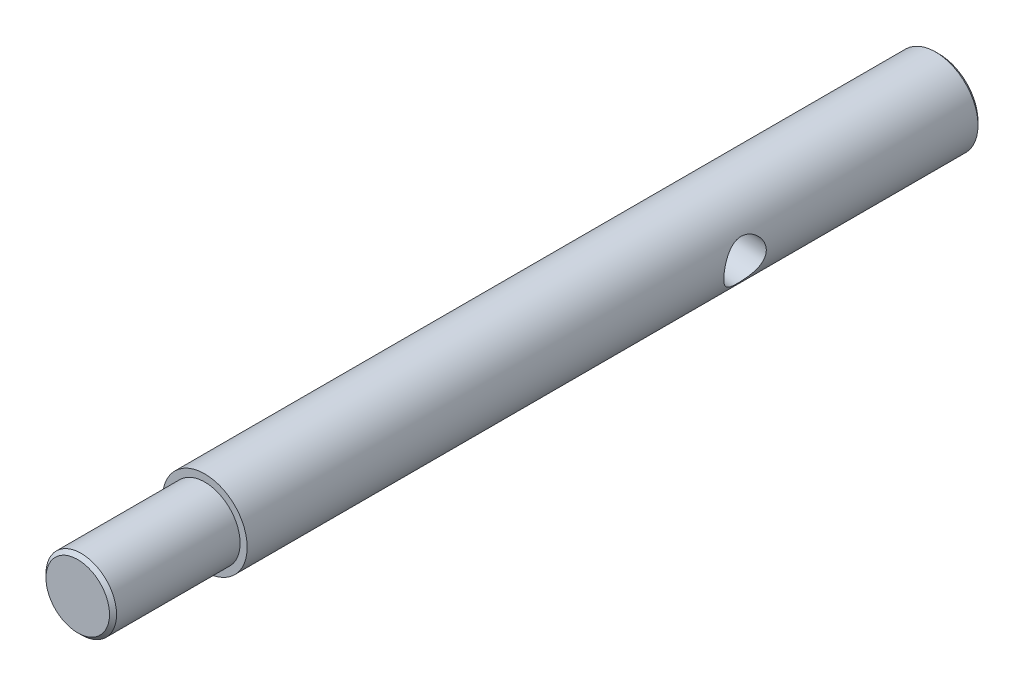
from build123d import *

# Parameters (mm, degrees)
SKETCH1_R             = 3
BOSS_EXTRUDE1_DEPTH   = 52
SKETCH2_R             = 2.5
BOSS_EXTRUDE2_DEPTH   = 9
CHAMFER1_SIZE         = 0.25
CHAMFER2_SIZE         = 0.25
F_3_0MM_DOWEL_HOLE1_D = 3


with BuildPart() as part:
    # Sketch1 → Boss-Extrude1 (new body)
    with BuildSketch(Plane.XY):
        with Locations(Location((0, 0, 0), (0, 0, 180))):
            Circle(SKETCH1_R)
    extrude(amount=BOSS_EXTRUDE1_DEPTH)

    # Sketch2 → Boss-Extrude2 (add)
    with BuildSketch(Plane.XY.offset(52)):
        Circle(SKETCH2_R)
    extrude(amount=BOSS_EXTRUDE2_DEPTH)

    # Chamfer1
    chamfer1_edges = [part.edges().sort_by_distance(p)[0] for p in [
        (-2.5, 0, 61),
    ]]
    chamfer(chamfer1_edges, length=CHAMFER1_SIZE)

    # Chamfer2
    chamfer2_edges = [part.edges().sort_by_distance(p)[0] for p in [
        (3, 0, 0),
    ]]
    chamfer(chamfer2_edges, length=CHAMFER2_SIZE)

    # Ø3.0mm Dowel Hole1 (through all)
    with Locations(Plane(origin=(2.990601236, -0.237285162, 16.733200531), x_dir=(0.079095054135, 0.996867078607, 0), z_dir=(0.996867078607, -0.079095054135, 0))):
        with Locations((0, 0)):
            Hole(F_3_0MM_DOWEL_HOLE1_D / 2)


solid = part.part
